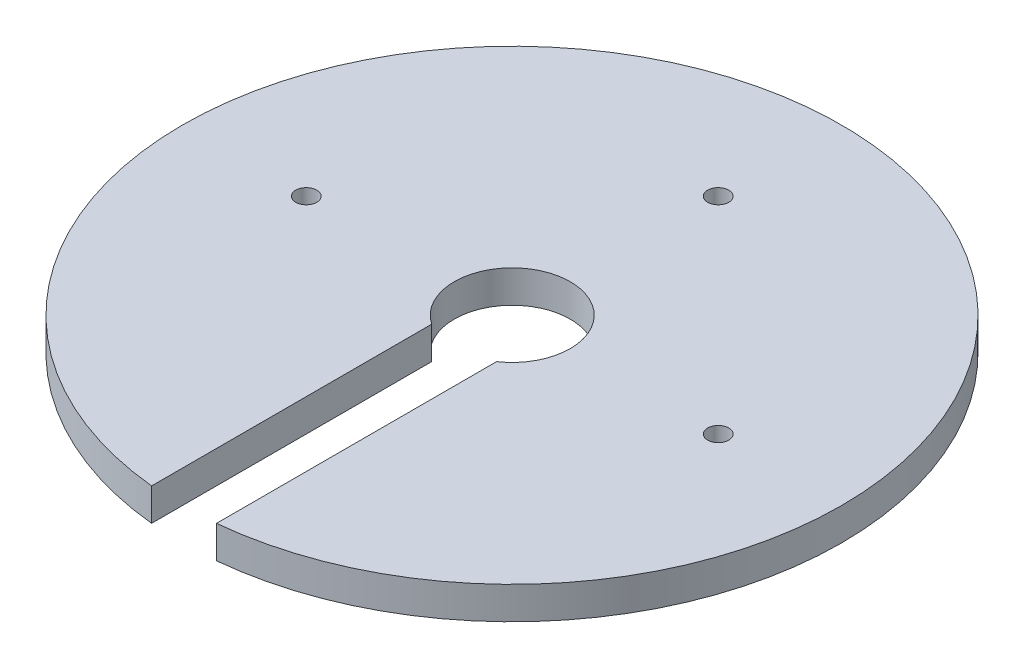
from build123d import *

# Parameters (mm, degrees)
SKETCH1_R           = 101.6
BOSS_EXTRUDE1_DEPTH = 10
SKETCH2_R           = 3.25
CUT_EXTRUDE1_DEPTH  = 145.031663186


with BuildPart() as part:
    # Sketch1 → Boss-Extrude1 (new body)
    with BuildSketch(Plane(origin=(0, 0, 0), x_dir=(1, 0, 0), z_dir=(0, 1, 0))):
        with Locations(Location((0, 0, 0), (0, 0, 270))):
            Circle(SKETCH1_R)
    extrude(amount=BOSS_EXTRUDE1_DEPTH)

    # Sketch2 → Cut-Extrude1 (cut, through all)
    with BuildSketch(Plane(origin=(0, 10, 0), x_dir=(1, 0, 0), z_dir=(0, 1, 0))):
        with Locations(Location((63.5, 0.070795045, 0), (0, 0, 270))):
            Circle(SKETCH2_R)
        with Locations(Location((-63.5, 0.070795045, 0), (0, 0, 270))):
            Circle(SKETCH2_R)
        with Locations(Location((0, 63.570795045, 0), (0, 0, 270))):
            Circle(SKETCH2_R)
        with BuildLine():
            Line((10, -14.746676337), (10, -101.106676337))
            ThreePointArc((10, -101.106676337), (0, -101.6), (-10, -101.106676337))
            Line((-10, -101.106676337), (-10, -14.746676337))
            ThreePointArc((-10, -14.746676337), (0, 17.946965165), (10, -14.746676337))
        make_face()
    extrude(amount=-CUT_EXTRUDE1_DEPTH, mode=Mode.SUBTRACT)


solid = part.part
